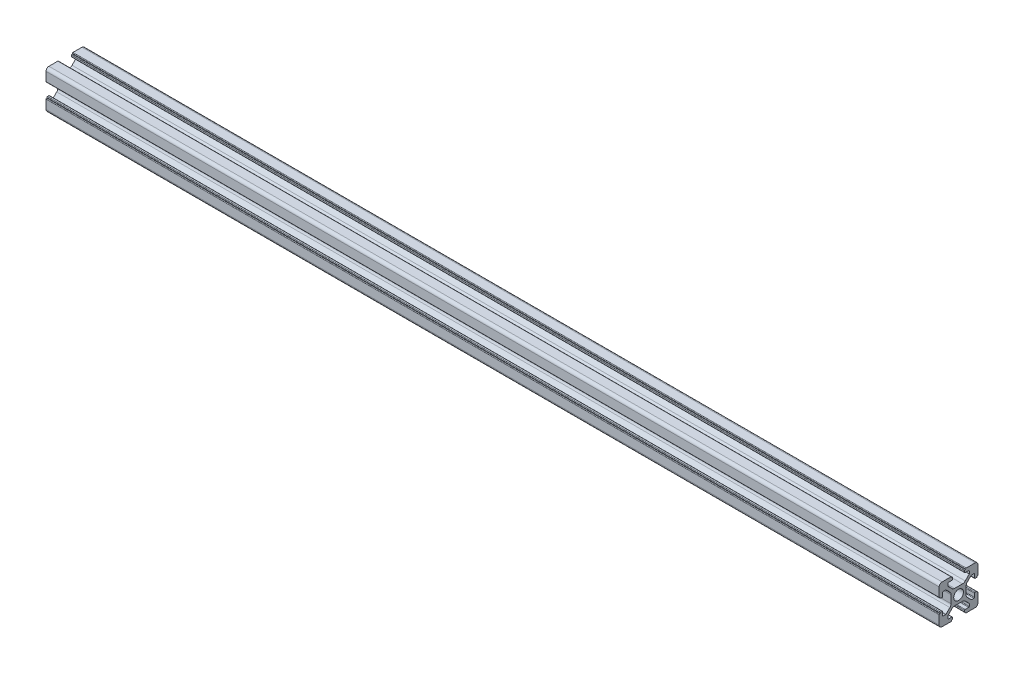
from build123d import *

# Parameters (mm, degrees)
SKETCH_1_R          = 2.5
MEMBER_2020_1_DEPTH = 460


with BuildPart() as part:
    # 草图1 → Member 2020_1 (new body)
    with BuildSketch(Plane.YZ.offset(-230)):
        with BuildLine():
            Line((3.9, 0), (3.9, -2.010912703))
            ThreePointArc((3.9, -2.010912703), (4.052240935, -2.776279568), (4.485786438, -3.425126266))
            Line((4.485786438, -3.425126266), (6.560660172, -5.5))
            Line((6.560660172, -5.5), (7.9, -5.5))
            ThreePointArc((7.9, -5.5), (8.112132034, -5.412132034), (8.2, -5.2))
            Line((8.2, -5.2), (8.2, -3.4))
            ThreePointArc((8.2, -3.4), (8.287867966, -3.187867966), (8.5, -3.1))
            Line((8.5, -3.1), (9.2, -3.1))
            ThreePointArc((9.2, -3.1), (9.412132034, -3.187867966), (9.5, -3.4))
            Line((9.5, -3.4), (9.5, -3.6))
            Line((9.5, -3.6), (9.7, -3.6))
            ThreePointArc((9.7, -3.6), (9.912132034, -3.687867966), (10, -3.9))
            Line((10, -3.9), (10, -8.5))
            ThreePointArc((10, -8.5), (9.560660172, -9.560660172), (8.5, -10))
            Line((8.5, -10), (3.9, -10))
            ThreePointArc((3.9, -10), (3.687867966, -9.912132034), (3.6, -9.7))
            ThreePointArc((3.6, -9.7), (3.541421356, -9.558578644), (3.4, -9.5))
            ThreePointArc((3.4, -9.5), (3.187867966, -9.412132034), (3.1, -9.2))
            Line((3.1, -9.2), (3.1, -8.5))
            ThreePointArc((3.1, -8.5), (3.187867966, -8.287867966), (3.4, -8.2))
            Line((3.4, -8.2), (5.2, -8.2))
            ThreePointArc((5.2, -8.2), (5.412132034, -8.112132034), (5.5, -7.9))
            Line((5.5, -7.9), (5.5, -6.68492424))
            ThreePointArc((5.5, -6.68492424), (5.47716386, -6.570119211), (5.412132034, -6.472792206))
            Line((5.412132034, -6.472792206), (3.425126266, -4.485786438))
            ThreePointArc((3.425126266, -4.485786438), (2.776279568, -4.052240935), (2.010912703, -3.9))
            Line((2.010912703, -3.9), (0, -3.9))
            Line((0, -3.9), (-2.010912703, -3.9))
            ThreePointArc((-2.010912703, -3.9), (-2.776279568, -4.052240935), (-3.425126266, -4.485786438))
            Line((-3.425126266, -4.485786438), (-5.412132034, -6.472792206))
            ThreePointArc((-5.412132034, -6.472792206), (-5.47716386, -6.570119211), (-5.5, -6.68492424))
            Line((-5.5, -6.68492424), (-5.5, -7.9))
            ThreePointArc((-5.5, -7.9), (-5.412132034, -8.112132034), (-5.2, -8.2))
            Line((-5.2, -8.2), (-3.4, -8.2))
            ThreePointArc((-3.4, -8.2), (-3.187867966, -8.287867966), (-3.1, -8.5))
            Line((-3.1, -8.5), (-3.1, -9.2))
            ThreePointArc((-3.1, -9.2), (-3.187867966, -9.412132034), (-3.4, -9.5))
            ThreePointArc((-3.4, -9.5), (-3.541421356, -9.558578644), (-3.6, -9.7))
            ThreePointArc((-3.6, -9.7), (-3.687867966, -9.912132034), (-3.9, -10))
            Line((-3.9, -10), (-8.5, -10))
            ThreePointArc((-8.5, -10), (-9.560660172, -9.560660172), (-10, -8.5))
            Line((-10, -8.5), (-10, -3.9))
            ThreePointArc((-10, -3.9), (-9.912132034, -3.687867966), (-9.7, -3.6))
            Line((-9.7, -3.6), (-9.5, -3.6))
            Line((-9.5, -3.6), (-9.5, -3.4))
            ThreePointArc((-9.5, -3.4), (-9.412132034, -3.187867966), (-9.2, -3.1))
            Line((-9.2, -3.1), (-8.5, -3.1))
            ThreePointArc((-8.5, -3.1), (-8.287867965, -3.187867966), (-8.2, -3.4))
            Line((-8.2, -3.4), (-8.2, -5.2))
            ThreePointArc((-8.2, -5.2), (-8.112132034, -5.412132034), (-7.9, -5.5))
            Line((-7.9, -5.5), (-6.68492424, -5.5))
            ThreePointArc((-6.68492424, -5.5), (-6.570119211, -5.47716386), (-6.472792206, -5.412132034))
            Line((-6.472792206, -5.412132034), (-4.485786438, -3.425126266))
            ThreePointArc((-4.485786438, -3.425126266), (-4.052240935, -2.776279568), (-3.9, -2.010912703))
            Line((-3.9, -2.010912703), (-3.9, 0))
            Line((-3.9, 0), (-3.9, 2.010912703))
            ThreePointArc((-3.9, 2.010912703), (-4.052240935, 2.776279568), (-4.485786438, 3.425126266))
            Line((-4.485786438, 3.425126266), (-6.472792206, 5.412132034))
            ThreePointArc((-6.472792206, 5.412132034), (-6.570119211, 5.47716386), (-6.68492424, 5.5))
            Line((-6.68492424, 5.5), (-7.9, 5.5))
            ThreePointArc((-7.9, 5.5), (-8.112132034, 5.412132034), (-8.2, 5.2))
            Line((-8.2, 5.2), (-8.2, 3.4))
            ThreePointArc((-8.2, 3.4), (-8.287867965, 3.187867966), (-8.5, 3.1))
            Line((-8.5, 3.1), (-9.2, 3.1))
            ThreePointArc((-9.2, 3.1), (-9.412132034, 3.187867966), (-9.5, 3.4))
            Line((-9.5, 3.4), (-9.5, 3.6))
            Line((-9.5, 3.6), (-9.7, 3.6))
            ThreePointArc((-9.7, 3.6), (-9.912132034, 3.687867966), (-10, 3.9))
            Line((-10, 3.9), (-10, 8.5))
            ThreePointArc((-10, 8.5), (-9.560660172, 9.560660172), (-8.5, 10))
            Line((-8.5, 10), (-3.9, 10))
            ThreePointArc((-3.9, 10), (-3.687867966, 9.912132034), (-3.6, 9.7))
            Line((-3.6, 9.7), (-3.6, 9.5))
            Line((-3.6, 9.5), (-3.4, 9.5))
            ThreePointArc((-3.4, 9.5), (-3.187867966, 9.412132034), (-3.1, 9.2))
            Line((-3.1, 9.2), (-3.1, 8.5))
            ThreePointArc((-3.1, 8.5), (-3.187867966, 8.287867966), (-3.4, 8.2))
            Line((-3.4, 8.2), (-5.2, 8.2))
            ThreePointArc((-5.2, 8.2), (-5.412132034, 8.112132034), (-5.5, 7.9))
            Line((-5.5, 7.9), (-5.5, 6.68492424))
            ThreePointArc((-5.5, 6.68492424), (-5.47716386, 6.570119211), (-5.412132034, 6.472792206))
            Line((-5.412132034, 6.472792206), (-3.425126266, 4.485786438))
            ThreePointArc((-3.425126266, 4.485786438), (-2.776279568, 4.052240935), (-2.010912703, 3.9))
            Line((-2.010912703, 3.9), (0, 3.9))
            Line((0, 3.9), (2.010912703, 3.9))
            ThreePointArc((2.010912703, 3.9), (2.776279568, 4.052240935), (3.425126266, 4.485786438))
            Line((3.425126266, 4.485786438), (5.412132034, 6.472792206))
            ThreePointArc((5.412132034, 6.472792206), (5.47716386, 6.570119211), (5.5, 6.68492424))
            Line((5.5, 6.68492424), (5.5, 7.9))
            ThreePointArc((5.5, 7.9), (5.412132034, 8.112132034), (5.2, 8.2))
            Line((5.2, 8.2), (3.4, 8.2))
            ThreePointArc((3.4, 8.2), (3.187867966, 8.287867966), (3.1, 8.5))
            Line((3.1, 8.5), (3.1, 9.2))
            ThreePointArc((3.1, 9.2), (3.187867966, 9.412132034), (3.4, 9.5))
            Line((3.4, 9.5), (3.6, 9.5))
            Line((3.6, 9.5), (3.6, 9.7))
            ThreePointArc((3.6, 9.7), (3.687867966, 9.912132034), (3.9, 10))
            Line((3.9, 10), (8.5, 10))
            ThreePointArc((8.5, 10), (9.560660172, 9.560660172), (10, 8.5))
            Line((10, 8.5), (10, 3.9))
            ThreePointArc((10, 3.9), (9.912132034, 3.687867966), (9.7, 3.6))
            Line((9.7, 3.6), (9.5, 3.6))
            Line((9.5, 3.6), (9.5, 3.4))
            ThreePointArc((9.5, 3.4), (9.412132034, 3.187867966), (9.2, 3.1))
            Line((9.2, 3.1), (8.5, 3.1))
            ThreePointArc((8.5, 3.1), (8.287867966, 3.187867966), (8.2, 3.4))
            Line((8.2, 3.4), (8.2, 5.2))
            ThreePointArc((8.2, 5.2), (8.112132034, 5.412132034), (7.9, 5.5))
            Line((7.9, 5.5), (6.68492424, 5.5))
            ThreePointArc((6.68492424, 5.5), (6.570119211, 5.47716386), (6.472792206, 5.412132034))
            Line((6.472792206, 5.412132034), (4.485786438, 3.425126266))
            ThreePointArc((4.485786438, 3.425126266), (4.052240935, 2.776279568), (3.9, 2.010912703))
            Line((3.9, 2.010912703), (3.9, 0))
        make_face()
        Circle(SKETCH_1_R, mode=Mode.SUBTRACT)
    extrude(amount=MEMBER_2020_1_DEPTH)


solid = part.part
